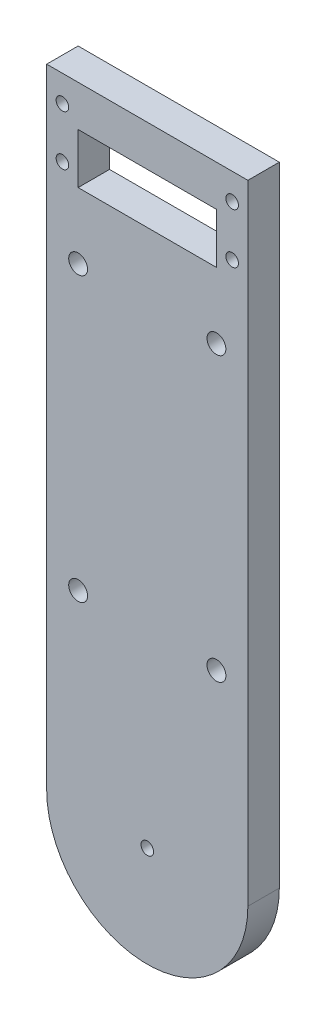
from build123d import *

# Parameters (mm, degrees)
SKETCH1_R           = 1
BOSS_EXTRUDE1_DEPTH = 5
SKETCH2_R           = 5.5
CUT_EXTRUDE1_DEPTH  = 3
SKETCH3_R           = 1.5
CUT_EXTRUDE2_DEPTH  = 82.737384348
SKETCH4_W           = 32
SKETCH4_H           = 20
SKETCH4_R           = 1
SKETCH4_W_2         = 22
SKETCH4_H_2         = 8
BOSS_EXTRUDE2_DEPTH = 5
CUT_EXTRUDE3_DEPTH  = 1.5


with BuildPart() as part:
    # Sketch1 → Boss-Extrude1 (new body)
    with BuildSketch(Plane.XY):
        with BuildLine():
            Line((-16, 0), (-16, 80))
            Line((-16, 80), (16, 80))
            Line((16, 80), (16, 0))
            ThreePointArc((16, 0), (0, -16), (-16, 0))
        make_face()
        Circle(SKETCH1_R, mode=Mode.SUBTRACT)
    extrude(amount=BOSS_EXTRUDE1_DEPTH)

    # Sketch2 → Cut-Extrude1 (cut)
    with BuildSketch(Plane(origin=(0, 0, 0), x_dir=(-1, 0, 0), z_dir=(0, 0, -1))):
        Circle(SKETCH2_R)
    extrude(amount=-CUT_EXTRUDE1_DEPTH, mode=Mode.SUBTRACT)

    # Sketch3 → Cut-Extrude2 (cut, through all)
    with BuildSketch(Plane.XY.offset(5)):
        with Locations((-11, 75)):
            Circle(SKETCH3_R)
        with Locations((11, 75)):
            Circle(SKETCH3_R)
        with Locations((-11, 30)):
            Circle(SKETCH3_R)
        with Locations((11, 30)):
            Circle(SKETCH3_R)
    extrude(amount=-CUT_EXTRUDE2_DEPTH, mode=Mode.SUBTRACT)

    # Sketch4 → Boss-Extrude2 (add)
    with BuildSketch(Plane.XY.offset(5)):
        with Locations((0, 90)):
            Rectangle(SKETCH4_W, SKETCH4_H)
        with Locations((-13.5, 95.8)):
            Circle(SKETCH4_R, mode=Mode.SUBTRACT)
        with Locations((13.5, 95.8)):
            Circle(SKETCH4_R, mode=Mode.SUBTRACT)
        with Locations((-13.5, 87.8)):
            Circle(SKETCH4_R, mode=Mode.SUBTRACT)
        with Locations((13.5, 87.8)):
            Circle(SKETCH4_R, mode=Mode.SUBTRACT)
        with Locations((0, 89.5)):
            Rectangle(SKETCH4_W_2, SKETCH4_H_2, mode=Mode.SUBTRACT)
    extrude(amount=-BOSS_EXTRUDE2_DEPTH)

    # Sketch5 → Cut-Extrude3 (cut)
    with BuildSketch(Plane.XY):
        Polygon((-8.113248654, 75), (-9.556624327, 77.5), (-12.443375673, 77.5), (-13.886751346, 75), (-12.443375673, 72.5), (-9.556624327, 72.5), align=None)
        Polygon((8.113248654, 75), (9.556624327, 72.5), (12.443375673, 72.5), (13.886751346, 75), (12.443375673, 77.5), (9.556624327, 77.5), align=None)
        Polygon((8.113248654, 30), (9.556624327, 27.5), (12.443375673, 27.5), (13.886751346, 30), (12.443375673, 32.5), (9.556624327, 32.5), align=None)
        Polygon((-8.113248654, 30), (-9.556624327, 32.5), (-12.443375673, 32.5), (-13.886751346, 30), (-12.443375673, 27.5), (-9.556624327, 27.5), align=None)
    extrude(amount=CUT_EXTRUDE3_DEPTH, mode=Mode.SUBTRACT)


solid = part.part
